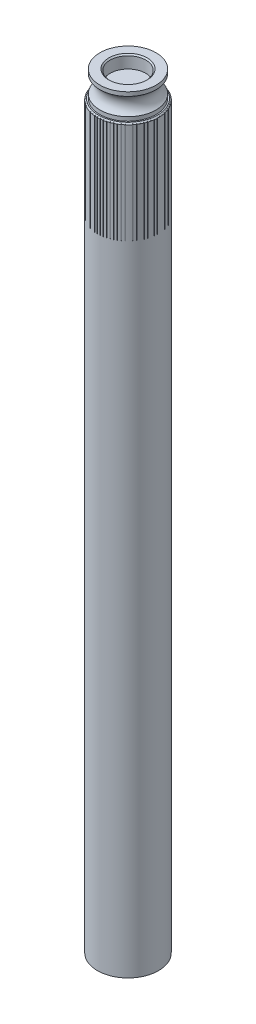
from build123d import *

# Parameters (mm, degrees)
SKETCH2_R          = 4.25
SKETCH3_R          = 7
CUT_EXTRUDE1_DEPTH = 5
CHAMFER1_SIZE      = 0.5
SKETCH4_W          = 0.1
SKETCH4_H          = 0.4
CUT_EXTRUDE2_DEPTH = 40
CIRPATTERN1_COUNT  = 70


with BuildPart() as part:
    # Sketch1 → Revolve1 (revolve)
    with BuildSketch(Plane.XY):
        Polygon((0, 0), (0, 300), (-11, 300), (-11, 290), (-12, 290), (-12, 0), align=None)
    revolve(axis=Axis((0, 0, 0), (0, 1, 0)))

    # Sketch2 → Cut-Revolve1 (revolve, cut)
    with BuildSketch(Plane.XY):
        with Locations((-13.5, 295)):
            Circle(SKETCH2_R)
    revolve(axis=Axis((0, 0, 0), (0, 1, 0)), mode=Mode.SUBTRACT)

    # Sketch3 → Cut-Extrude1 (cut)
    with BuildSketch(Plane(origin=(0, 300, 0), x_dir=(1, 0, 0), z_dir=(0, 1, 0))):
        Circle(SKETCH3_R)
    extrude(amount=-CUT_EXTRUDE1_DEPTH, mode=Mode.SUBTRACT)

    # Chamfer1
    chamfer1_edges = [part.edges().sort_by_distance(p)[0] for p in [
        (12, 290, 0),
        (-7, 300, 0),
    ]]
    chamfer(chamfer1_edges, length=CHAMFER1_SIZE)

    # Sketch4 → Cut-Extrude2 (cut)
    with BuildSketch(Plane(origin=(0, 290, 0), x_dir=(1, 0, 0), z_dir=(0, 1, 0))):
        with Locations((0, 12)):
            Rectangle(SKETCH4_W, SKETCH4_H)
    cut_extrude2 = extrude(amount=-CUT_EXTRUDE2_DEPTH, mode=Mode.SUBTRACT)

    # CirPattern1: Cut-Extrude2 ×70 about axis
    cirpattern1_axis = Axis((0, 300, 0), (0, -1, 0))
    for i in range(1, CIRPATTERN1_COUNT):
        add(cut_extrude2.rotate(cirpattern1_axis, i * 360 / CIRPATTERN1_COUNT), mode=Mode.SUBTRACT)


solid = part.part
